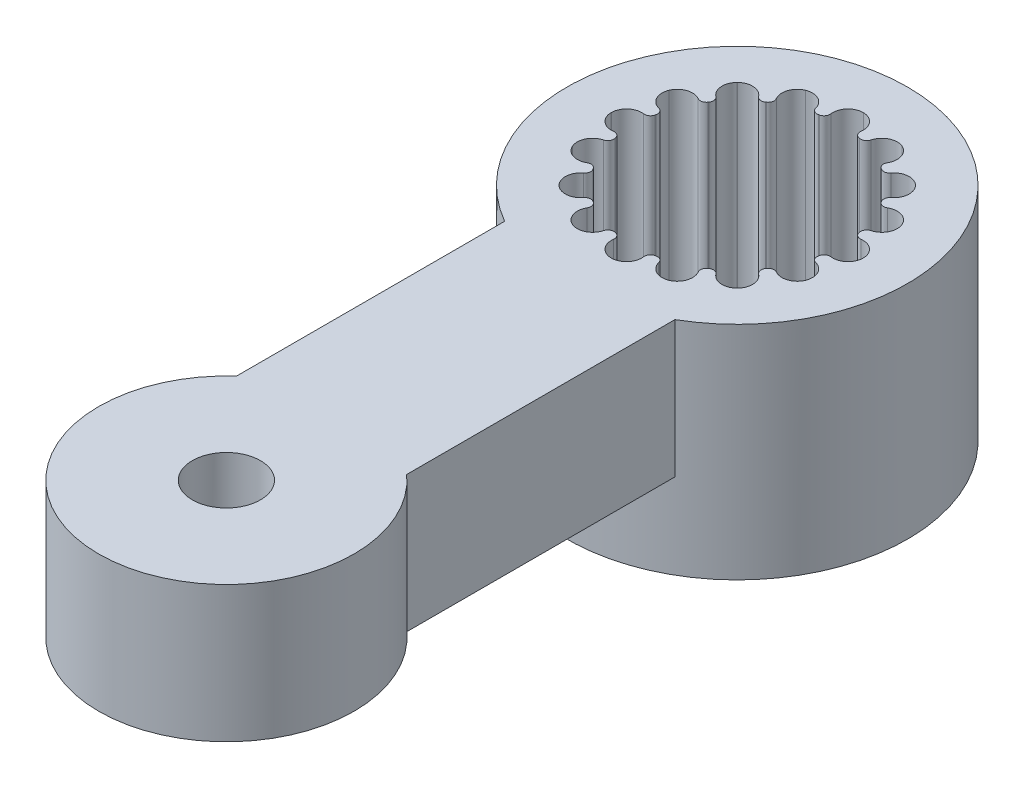
from build123d import *

# Parameters (mm, degrees)
SKETCH1_R                   = 10
SKETCH1_R_2                 = 6.1
BOSS_EXTRUDE1_DEPTH         = 8
CUT_EXTRUDE1_START          = -8
CUT_EXTRUDE1_DEPTH          = 8
BOSS_EXTRUDE2_START         = -8
SKETCH3_R                   = 2
BOSS_EXTRUDE2_DEPTH         = 8
CUT_EXTRUDE2_DEPTH          = 5
Y_KSEKLIK_EKSTR_ZYON1_START = 5
IZIM2_R                     = 10
Y_KSEKLIK_EKSTR_ZYON1_DEPTH = 5
KES_EKSTR_ZYON1_START       = -10
KES_EKSTR_ZYON1_DEPTH       = 10


with BuildPart() as part:
    # Sketch1 → Boss-Extrude1 (new body)
    with BuildSketch(Plane(origin=(0, 0, 0), x_dir=(1, 0, 0), z_dir=(0, 1, 0))):
        with Locations(Location((0, 0, 0), (0, 0, 270))):
            Circle(SKETCH1_R)
        with Locations(Location((0, 0, 0), (0, 0, 270))):
            Circle(SKETCH1_R_2, mode=Mode.SUBTRACT)
    extrude(amount=BOSS_EXTRUDE1_DEPTH)

    # Sketch2 → Cut-Extrude1 (cut)
    with BuildSketch(Plane(origin=(0, 8, 0), x_dir=(1, 0, 0), z_dir=(0, 1, 0)).offset(CUT_EXTRUDE1_START)):
        with BuildLine():
            ThreePointArc((0.000592926, 7.39999668), (0, 7.399998437), (-0.000592926, 7.39999668))
            ThreePointArc((-0.000592926, 7.39999668), (-0.67508744, 7.089783658), (-0.886982268, 6.378253229))
            ThreePointArc((-0.886982268, 6.378253229), (-0.949174145, 6.127166435), (-1.166816015, 5.987365062))
            ThreePointArc((-1.166816015, 5.987365062), (0, 6.1), (1.166816015, 5.987365062))
            ThreePointArc((1.166816015, 5.987365062), (0.949174145, 6.127166435), (0.886982268, 6.378253229))
            ThreePointArc((0.886982268, 6.378253229), (0.67508744, 7.089783658), (0.000592926, 7.39999668))
        make_face()
        with BuildLine():
            ThreePointArc((-3.36926347, 5.085082465), (-2.334369456, 5.635664934), (-1.213268347, 5.978125117))
            ThreePointArc((-1.213268347, 5.978125117), (-1.467842715, 6.023996683), (-1.621387356, 6.232170536))
            ThreePointArc((-1.621387356, 6.232170536), (-2.08944377, 6.808449475), (-2.831308337, 6.836930813))
            ThreePointArc((-2.831308337, 6.836930813), (-2.831856802, 6.836705534), (-2.832403921, 6.836477008))
            ThreePointArc((-2.832403921, 6.836477008), (-3.336842065, 6.291760116), (-3.260317075, 5.553303441))
            ThreePointArc((-3.260317075, 5.553303441), (-3.221688342, 5.297529849), (-3.36926347, 5.085082465))
        make_face()
        with BuildLine():
            ThreePointArc((1.621387392, 6.232171404), (1.467842902, 6.02399695), (1.213268174, 5.978125152))
            ThreePointArc((1.213268174, 5.978125152), (2.334368937, 5.635665148), (3.369262681, 5.085082987))
            ThreePointArc((3.369262681, 5.085082987), (3.221687424, 5.297530763), (3.260316642, 5.553304681))
            ThreePointArc((3.260316642, 5.553304681), (3.336842987, 6.291762152), (2.832404519, 6.836480014))
            ThreePointArc((2.832404519, 6.836480014), (2.8318574, 6.836708541), (2.831308935, 6.836933819))
            ThreePointArc((2.831308935, 6.836933819), (2.089443379, 6.808451987), (1.621387392, 6.232171404))
        make_face()
        with BuildLine():
            ThreePointArc((-5.058771029, 3.408641324), (-4.313352495, 4.313350235), (-3.408643974, 5.058769243))
            ThreePointArc((-3.408643974, 5.058769243), (-3.661394149, 5.003727588), (-3.882915569, 5.137295904))
            ThreePointArc((-3.882915569, 5.137295904), (-4.535875614, 5.490590075), (-5.232167973, 5.233004089))
            ThreePointArc((-5.232167973, 5.233004089), (-5.232588478, 5.23258607), (-5.233006497, 5.232165565))
            ThreePointArc((-5.233006497, 5.232165565), (-5.490592466, 4.535872971), (-5.137297939, 3.882912877))
            ThreePointArc((-5.137297939, 3.882912877), (-5.003729507, 3.661391527), (-5.058771029, 3.408641324))
        make_face()
        with BuildLine():
            ThreePointArc((3.8829153, 5.137298076), (3.661393736, 5.003728585), (3.408642774, 5.058770052))
            ThreePointArc((3.408642774, 5.058770052), (4.313350968, 4.313351762), (5.058769425, 3.408643705))
            ThreePointArc((5.058769425, 3.408643705), (5.003727912, 3.661394657), (5.137297361, 3.882916245))
            ThreePointArc((5.137297361, 3.882916245), (5.490594639, 4.535876723), (5.233008798, 5.232171119))
            ThreePointArc((5.233008798, 5.232171119), (5.232590779, 5.232591624), (5.232170274, 5.233009643))
            ThreePointArc((5.232170274, 5.233009643), (4.535875795, 5.490595479), (3.8829153, 5.137298076))
        make_face()
        with BuildLine():
            ThreePointArc((-5.97812586, 1.213264689), (-5.635666278, 2.334366209), (-5.085084285, 3.369260722))
            ThreePointArc((-5.085084285, 3.369260722), (-5.297531356, 3.221685534), (-5.553304788, 3.260313832))
            ThreePointArc((-5.553304788, 3.260313832), (-6.291760792, 3.336837682), (-6.836476867, 2.83239981))
            ThreePointArc((-6.836476867, 2.83239981), (-6.836705394, 2.831852691), (-6.836930673, 2.831304226))
            ThreePointArc((-6.836930673, 2.831304226), (-6.808449488, 2.089439967), (-6.232171062, 1.62138342))
            ThreePointArc((-6.232171062, 1.62138342), (-6.023997454, 1.467838824), (-5.97812586, 1.213264689))
        make_face()
        with BuildLine():
            ThreePointArc((5.553304623, 3.260318163), (5.297530442, 3.221688446), (5.085082285, 3.369263741))
            ThreePointArc((5.085082285, 3.369263741), (5.635664537, 2.334370414), (5.97812477, 1.213270061))
            ThreePointArc((5.97812477, 1.213270061), (6.023996677, 1.467845109), (6.23217159, 1.621389541))
            ThreePointArc((6.23217159, 1.621389541), (6.808453339, 2.089445226), (6.836935522, 2.831311483))
            ThreePointArc((6.836935522, 2.831311483), (6.836710243, 2.831859948), (6.836481716, 2.832407067))
            ThreePointArc((6.836481716, 2.832407067), (6.291762887, 3.336845858), (5.553304623, 3.260318163))
        make_face()
        with BuildLine():
            ThreePointArc((-5.98736414, -1.166820749), (-6.1, -4.42e-06), (-5.98736583, 1.166812073))
            ThreePointArc((-5.98736583, 1.166812073), (-6.127166699, 0.949170369), (-6.378252933, 0.886977948))
            ThreePointArc((-6.378252933, 0.886977948), (-7.089781598, 0.675081789), (-7.399993533, 0.000588217))
            ThreePointArc((-7.399993533, 0.000588217), (-7.399995291, -4.709e-06), (-7.399993533, -0.000597635))
            ThreePointArc((-7.399993533, -0.000597635), (-7.089781107, -0.675091633), (-6.378251646, -0.886987191))
            ThreePointArc((-6.378251646, -0.886987191), (-6.127165323, -0.949179249), (-5.98736414, -1.166820749))
        make_face()
        with BuildLine():
            ThreePointArc((6.378254206, 0.886984905), (6.127166611, 0.949176118), (5.987364613, 1.166818322))
            ThreePointArc((5.987364613, 1.166818322), (6.1, 2.953e-06), (5.987365742, -1.166812525))
            ThreePointArc((5.987365742, -1.166812525), (6.12716753, -0.949170185), (6.378255066, -0.88697873))
            ThreePointArc((6.378255066, -0.88697873), (7.089787272, -0.675085244), (7.400001389, -0.000589779))
            ThreePointArc((7.400001389, -0.000589779), (7.400003146, 3.146e-06), (7.400001389, 0.000596072))
            ThreePointArc((7.400001389, 0.000596072), (7.089786944, 0.675091821), (6.378254206, 0.886984905))
        make_face()
        with BuildLine():
            ThreePointArc((-5.085079507, -3.369267934), (-5.635662939, -2.334374272), (-5.978124109, -1.213273317))
            ThreePointArc((-5.978124109, -1.213273317), (-6.023995381, -1.467847591), (-6.232168887, -1.621392458))
            ThreePointArc((-6.232168887, -1.621392458), (-6.808446674, -2.089449171), (-6.836927667, -2.831313046))
            ThreePointArc((-6.836927667, -2.831313046), (-6.836702388, -2.83186151), (-6.836473861, -2.83240863))
            ThreePointArc((-6.836473861, -2.83240863), (-6.291756977, -3.336846772), (-5.553300309, -3.260321792))
            ThreePointArc((-5.553300309, -3.260321792), (-5.297526868, -3.221693028), (-5.085079507, -3.369267934))
        make_face()
        with BuildLine():
            ThreePointArc((-3.408637118, -5.058773863), (-4.313346549, -4.313356182), (-5.058766251, -3.408648415))
            ThreePointArc((-5.058766251, -3.408648415), (-5.0037244, -3.661398696), (-5.137292745, -3.882920269))
            ThreePointArc((-5.137292745, -3.882920269), (-5.490586928, -4.535880315), (-5.233000942, -5.232172682))
            ThreePointArc((-5.233000942, -5.232172682), (-5.232582923, -5.232593187), (-5.232162418, -5.233011206))
            ThreePointArc((-5.232162418, -5.233011206), (-4.535869052, -5.49059712), (-3.882908794, -5.137301415))
            ThreePointArc((-3.882908794, -5.137301415), (-3.66138752, -5.003732576), (-3.408637118, -5.058773863))
        make_face()
        with BuildLine():
            ThreePointArc((6.232173331, -1.621383514), (6.023998151, -1.467839313), (5.978125951, -1.213264238))
            ThreePointArc((5.978125951, -1.213264238), (5.63566684, -2.334364854), (5.085085651, -3.36925866))
            ThreePointArc((5.085085651, -3.36925866), (5.297533744, -3.221683134), (5.553308028, -3.2603127))
            ThreePointArc((5.553308028, -3.2603127), (6.291766112, -3.33684009), (6.836484723, -2.832401372))
            ThreePointArc((6.836484723, -2.832401372), (6.83671325, -2.831854253), (6.836938528, -2.831305788))
            ThreePointArc((6.836938528, -2.831305788), (6.808456053, -2.089438946), (6.232173331, -1.621383514))
        make_face()
        with BuildLine():
            ThreePointArc((-1.213260753, -5.978126659), (-2.334362126, -5.63566797), (-3.369256702, -5.085086949))
            ThreePointArc((-3.369256702, -5.085086949), (-3.221681245, -5.297534337), (-3.26030989, -5.553308135))
            ThreePointArc((-3.26030989, -5.553308135), (-3.336834785, -6.291764753), (-2.832396664, -6.836481576))
            ThreePointArc((-2.832396664, -6.836481576), (-2.831849544, -6.836710103), (-2.831301079, -6.836935382))
            ThreePointArc((-2.831301079, -6.836935382), (-2.089435534, -6.808453554), (-1.621379542, -6.232172989))
            ThreePointArc((-1.621379542, -6.232172989), (-1.467835235, -6.023998655), (-1.213260753, -5.978126659))
        make_face()
        with BuildLine():
            ThreePointArc((5.137301552, -3.882911216), (5.003731655, -3.661389729), (5.058772886, -3.408638568))
            ThreePointArc((5.058772886, -3.408638568), (4.313355448, -4.313347282), (3.408648146, -5.058766433))
            ThreePointArc((3.408648146, -5.058766433), (3.661399204, -5.003724723), (3.882920944, -5.137294202))
            ThreePointArc((3.882920944, -5.137294202), (4.535881424, -5.490591492), (5.232175828, -5.233005651))
            ThreePointArc((5.232175828, -5.233005651), (5.232596333, -5.232587632), (5.233014352, -5.232167127))
            ThreePointArc((5.233014352, -5.232167127), (5.490600133, -4.535871876), (5.137301552, -3.882911216))
        make_face()
        with BuildLine():
            ThreePointArc((1.166823055, -5.98736369), (7.373e-06, -6.1), (-1.166808582, -5.987366511))
            ThreePointArc((-1.166808582, -5.987366511), (-0.94916641, -6.127167794), (-0.88697441, -6.37825477))
            ThreePointArc((-0.88697441, -6.37825477), (-0.675079592, -7.089785212), (-0.000585071, -7.399998242))
            ThreePointArc((-0.000585071, -7.399998242), (7.855e-06, -7.4), (0.000600781, -7.399998242))
            ThreePointArc((0.000600781, -7.399998242), (0.675096013, -7.089784394), (0.886989827, -6.378252622))
            ThreePointArc((0.886989827, -6.378252622), (0.949181221, -6.127165498), (1.166823055, -5.98736369))
        make_face()
        with BuildLine():
            ThreePointArc((3.260322879, -5.553301491), (3.221693132, -5.297527461), (3.369268205, -5.085079327))
            ThreePointArc((3.369268205, -5.085079327), (2.33437523, -5.635662542), (1.213275031, -5.978123761))
            ThreePointArc((1.213275031, -5.978123761), (1.467849985, -6.023995375), (1.621394644, -6.232169941))
            ThreePointArc((1.621394644, -6.232169941), (2.089450627, -6.808450539), (2.831316192, -6.836932376))
            ThreePointArc((2.831316192, -6.836932376), (2.831864657, -6.836707097), (2.832411776, -6.83647857))
            ThreePointArc((2.832411776, -6.83647857), (3.336850564, -6.291759749), (3.260322879, -5.553301491))
        make_face()
    extrude(amount=CUT_EXTRUDE1_DEPTH, mode=Mode.SUBTRACT)

    # Sketch3 → Boss-Extrude2 (add)
    with BuildSketch(Plane(origin=(0, 8, 0), x_dir=(1, 0, 0), z_dir=(0, 1, 0)).offset(BOSS_EXTRUDE2_START)):
        with BuildLine():
            Line((-5, -8.660254038), (-5, -24.409830056))
            ThreePointArc((-5, -24.409830056), (0, -37.5), (5, -24.409830056))
            Line((5, -24.409830056), (5, -8.660254038))
            ThreePointArc((5, -8.660254038), (0, -10), (-5, -8.660254038))
        make_face()
        with Locations(Location((0, -30, 0), (0, 0, 270))):
            Circle(SKETCH3_R, mode=Mode.SUBTRACT)
    extrude(amount=BOSS_EXTRUDE2_DEPTH)

    # Sketch4 → Cut-Extrude2 (cut)
    with BuildSketch(Plane.XZ):
        Polygon((2.107328483, 33.65), (-2.107328483, 33.65), (-4.214656965, 30), (-2.107328483, 26.35), (2.107328483, 26.35), (4.214656965, 30), align=None)
    extrude(amount=-CUT_EXTRUDE2_DEPTH, mode=Mode.SUBTRACT)

    # Çizim2 → Yükseklik-Ekstrüzyon1 (add)
    with BuildSketch(Plane.XZ.offset(Y_KSEKLIK_EKSTR_ZYON1_START)):
        with Locations(Location((0, 0, 0), (0, 0, 270))):
            Circle(IZIM2_R)
    extrude(amount=-Y_KSEKLIK_EKSTR_ZYON1_DEPTH)

    # Çizim3 → Kes-Ekstrüzyon1 (cut)
    with BuildSketch(Plane(origin=(0, 0, 0), x_dir=(1, 0, 0), z_dir=(0, 1, 0)).offset(KES_EKSTR_ZYON1_START)):
        with BuildLine():
            Line((-0.000585071, -7.399998242), (0.000600781, -7.399998242))
            ThreePointArc((0.000600781, -7.399998242), (0.675096013, -7.089784394), (0.886989827, -6.378252622))
            ThreePointArc((0.886989827, -6.378252622), (0.949181221, -6.127165498), (1.166823055, -5.98736369))
            ThreePointArc((1.166823055, -5.98736369), (1.190058011, -5.982788809), (1.213275031, -5.978123761))
            ThreePointArc((1.213275031, -5.978123761), (1.467849985, -6.023995375), (1.621394644, -6.232169941))
            ThreePointArc((1.621394644, -6.232169941), (2.089450627, -6.808450539), (2.831316192, -6.836932376))
            Line((2.831316192, -6.836932376), (2.832411776, -6.83647857))
            ThreePointArc((2.832411776, -6.83647857), (3.336850564, -6.291759749), (3.260322879, -5.553301491))
            ThreePointArc((3.260322879, -5.553301491), (3.221693132, -5.297527461), (3.369268205, -5.085079327))
            ThreePointArc((3.369268205, -5.085079327), (3.388983713, -5.0719611), (3.408648146, -5.058766433))
            ThreePointArc((3.408648146, -5.058766433), (3.661399204, -5.003724723), (3.882920944, -5.137294202))
            ThreePointArc((3.882920944, -5.137294202), (4.535881424, -5.490591492), (5.232175828, -5.233005651))
            Line((5.232175828, -5.233005651), (5.233014352, -5.232167127))
            ThreePointArc((5.233014352, -5.232167127), (5.490600133, -4.535871876), (5.137301552, -3.882911216))
            ThreePointArc((5.137301552, -3.882911216), (5.003731655, -3.661389729), (5.058772886, -3.408638568))
            ThreePointArc((5.058772886, -3.408638568), (5.071967488, -3.388974152), (5.085085651, -3.36925866))
            ThreePointArc((5.085085651, -3.36925866), (5.297533744, -3.221683134), (5.553308028, -3.2603127))
            ThreePointArc((5.553308028, -3.2603127), (6.291766112, -3.33684009), (6.836484723, -2.832401372))
            Line((6.836484723, -2.832401372), (6.836938528, -2.831305788))
            ThreePointArc((6.836938528, -2.831305788), (6.808456053, -2.089438946), (6.232173331, -1.621383514))
            ThreePointArc((6.232173331, -1.621383514), (6.023998151, -1.467839313), (5.978125951, -1.213264238))
            ThreePointArc((5.978125951, -1.213264238), (5.98279093, -1.190047349), (5.987365742, -1.166812525))
            ThreePointArc((5.987365742, -1.166812525), (6.12716753, -0.949170185), (6.378255066, -0.88697873))
            ThreePointArc((6.378255066, -0.88697873), (7.089787272, -0.675085244), (7.400001389, -0.000589779))
            Line((7.400001389, -0.000589779), (7.400001389, 0.000596072))
            ThreePointArc((7.400001389, 0.000596072), (7.089786944, 0.675091821), (6.378254206, 0.886984905))
            ThreePointArc((6.378254206, 0.886984905), (6.127166611, 0.949176118), (5.987364613, 1.166818322))
            ThreePointArc((5.987364613, 1.166818322), (5.982789774, 1.190053159), (5.97812477, 1.213270061))
            ThreePointArc((5.97812477, 1.213270061), (6.023996677, 1.467845109), (6.23217159, 1.621389541))
            ThreePointArc((6.23217159, 1.621389541), (6.808453339, 2.089445226), (6.836935522, 2.831311483))
            Line((6.836935522, 2.831311483), (6.836481716, 2.832407067))
            ThreePointArc((6.836481716, 2.832407067), (6.291762887, 3.336845858), (5.553304623, 3.260318163))
            ThreePointArc((5.553304623, 3.260318163), (5.297530442, 3.221688446), (5.085082285, 3.369263741))
            ThreePointArc((5.085082285, 3.369263741), (5.071964075, 3.38897926), (5.058769425, 3.408643705))
            ThreePointArc((5.058769425, 3.408643705), (5.003727912, 3.661394657), (5.137297361, 3.882916245))
            ThreePointArc((5.137297361, 3.882916245), (5.490594639, 4.535876723), (5.233008798, 5.232171119))
            Line((5.233008798, 5.232171119), (5.232170274, 5.233009643))
            ThreePointArc((5.232170274, 5.233009643), (4.535875795, 5.490595479), (3.8829153, 5.137298076))
            ThreePointArc((3.8829153, 5.137298076), (3.661393736, 5.003728585), (3.408642774, 5.058770052))
            ThreePointArc((3.408642774, 5.058770052), (3.388978265, 5.07196474), (3.369262681, 5.085082987))
            ThreePointArc((3.369262681, 5.085082987), (3.221687424, 5.297530763), (3.260316642, 5.553304681))
            ThreePointArc((3.260316642, 5.553304681), (3.336842987, 6.291762152), (2.832404519, 6.836480014))
            Line((2.832404519, 6.836480014), (2.831308935, 6.836933819))
            ThreePointArc((2.831308935, 6.836933819), (2.089443379, 6.808451987), (1.621387392, 6.232171404))
            ThreePointArc((1.621387392, 6.232171404), (1.467842902, 6.02399695), (1.213268174, 5.978125152))
            ThreePointArc((1.213268174, 5.978125152), (1.190051062, 5.982790191), (1.166816015, 5.987365062))
            ThreePointArc((1.166816015, 5.987365062), (0.949174145, 6.127166435), (0.886982268, 6.378253229))
            ThreePointArc((0.886982268, 6.378253229), (0.67508744, 7.089783658), (0.000592926, 7.39999668))
            Line((0.000592926, 7.39999668), (-0.000592926, 7.39999668))
            ThreePointArc((-0.000592926, 7.39999668), (-0.67508744, 7.089783658), (-0.886982268, 6.378253229))
            ThreePointArc((-0.886982268, 6.378253229), (-0.949174145, 6.127166435), (-1.166816015, 5.987365062))
            ThreePointArc((-1.166816015, 5.987365062), (-1.190051149, 5.982790174), (-1.213268347, 5.978125117))
            ThreePointArc((-1.213268347, 5.978125117), (-1.467842715, 6.023996683), (-1.621387356, 6.232170536))
            ThreePointArc((-1.621387356, 6.232170536), (-2.08944377, 6.808449475), (-2.831308337, 6.836930813))
            Line((-2.831308337, 6.836930813), (-2.832403921, 6.836477008))
            ThreePointArc((-2.832403921, 6.836477008), (-3.336842065, 6.291760116), (-3.260317075, 5.553303441))
            ThreePointArc((-3.260317075, 5.553303441), (-3.221688342, 5.297529849), (-3.36926347, 5.085082465))
            ThreePointArc((-3.36926347, 5.085082465), (-3.38897926, 5.071964075), (-3.408643974, 5.058769243))
            ThreePointArc((-3.408643974, 5.058769243), (-3.661394149, 5.003727588), (-3.882915569, 5.137295904))
            ThreePointArc((-3.882915569, 5.137295904), (-4.535875614, 5.490590075), (-5.232167973, 5.233004089))
            Line((-5.232167973, 5.233004089), (-5.233006497, 5.232165565))
            ThreePointArc((-5.233006497, 5.232165565), (-5.490592466, 4.535872971), (-5.137297939, 3.882912877))
            ThreePointArc((-5.137297939, 3.882912877), (-5.003729507, 3.661391527), (-5.058771029, 3.408641324))
            ThreePointArc((-5.058771029, 3.408641324), (-5.071965878, 3.388976561), (-5.085084285, 3.369260722))
            ThreePointArc((-5.085084285, 3.369260722), (-5.297531356, 3.221685534), (-5.553304788, 3.260313832))
            ThreePointArc((-5.553304788, 3.260313832), (-6.291760792, 3.336837682), (-6.836476867, 2.83239981))
            Line((-6.836476867, 2.83239981), (-6.836930673, 2.831304226))
            ThreePointArc((-6.836930673, 2.831304226), (-6.808449488, 2.089439967), (-6.232171062, 1.62138342))
            ThreePointArc((-6.232171062, 1.62138342), (-6.023997454, 1.467838824), (-5.97812586, 1.213264689))
            ThreePointArc((-5.97812586, 1.213264689), (-5.98279093, 1.190047349), (-5.98736583, 1.166812073))
            ThreePointArc((-5.98736583, 1.166812073), (-6.127166699, 0.949170369), (-6.378252933, 0.886977948))
            ThreePointArc((-6.378252933, 0.886977948), (-7.089781598, 0.675081789), (-7.399993533, 0.000588217))
            Line((-7.399993533, 0.000588217), (-7.399993533, -0.000597635))
            ThreePointArc((-7.399993533, -0.000597635), (-7.089781107, -0.675091633), (-6.378251646, -0.886987191))
            ThreePointArc((-6.378251646, -0.886987191), (-6.127165323, -0.949179249), (-5.98736414, -1.166820749))
            ThreePointArc((-5.98736414, -1.166820749), (-5.982789209, -1.190056001), (-5.978124109, -1.213273317))
            ThreePointArc((-5.978124109, -1.213273317), (-6.023995381, -1.467847591), (-6.232168887, -1.621392458))
            ThreePointArc((-6.232168887, -1.621392458), (-6.808446674, -2.089449171), (-6.836927667, -2.831313046))
            Line((-6.836927667, -2.831313046), (-6.836473861, -2.83240863))
            ThreePointArc((-6.836473861, -2.83240863), (-6.291756977, -3.336846772), (-5.553300309, -3.260321792))
            ThreePointArc((-5.553300309, -3.260321792), (-5.297526868, -3.221693028), (-5.085079507, -3.369267934))
            ThreePointArc((-5.085079507, -3.369267934), (-5.0719611, -3.388983713), (-5.058766251, -3.408648415))
            ThreePointArc((-5.058766251, -3.408648415), (-5.0037244, -3.661398696), (-5.137292745, -3.882920269))
            ThreePointArc((-5.137292745, -3.882920269), (-5.490586928, -4.535880315), (-5.233000942, -5.232172682))
            Line((-5.233000942, -5.232172682), (-5.232162418, -5.233011206))
            ThreePointArc((-5.232162418, -5.233011206), (-4.535869052, -5.49059712), (-3.882908794, -5.137301415))
            ThreePointArc((-3.882908794, -5.137301415), (-3.66138752, -5.003732576), (-3.408637118, -5.058773863))
            ThreePointArc((-3.408637118, -5.058773863), (-3.388972448, -5.071968627), (-3.369256702, -5.085086949))
            ThreePointArc((-3.369256702, -5.085086949), (-3.221681245, -5.297534337), (-3.26030989, -5.553308135))
            ThreePointArc((-3.26030989, -5.553308135), (-3.336834785, -6.291764753), (-2.832396664, -6.836481576))
            Line((-2.832396664, -6.836481576), (-2.831301079, -6.836935382))
            ThreePointArc((-2.831301079, -6.836935382), (-2.089435534, -6.808453554), (-1.621379542, -6.232172989))
            ThreePointArc((-1.621379542, -6.232172989), (-1.467835235, -6.023998655), (-1.213260753, -5.978126659))
            ThreePointArc((-1.213260753, -5.978126659), (-1.190043635, -5.982791668), (-1.166808582, -5.987366511))
            ThreePointArc((-1.166808582, -5.987366511), (-0.94916641, -6.127167794), (-0.88697441, -6.37825477))
            ThreePointArc((-0.88697441, -6.37825477), (-0.675079592, -7.089785212), (-0.000585071, -7.399998242))
        make_face()
    extrude(amount=KES_EKSTR_ZYON1_DEPTH, mode=Mode.SUBTRACT)


solid = part.part
